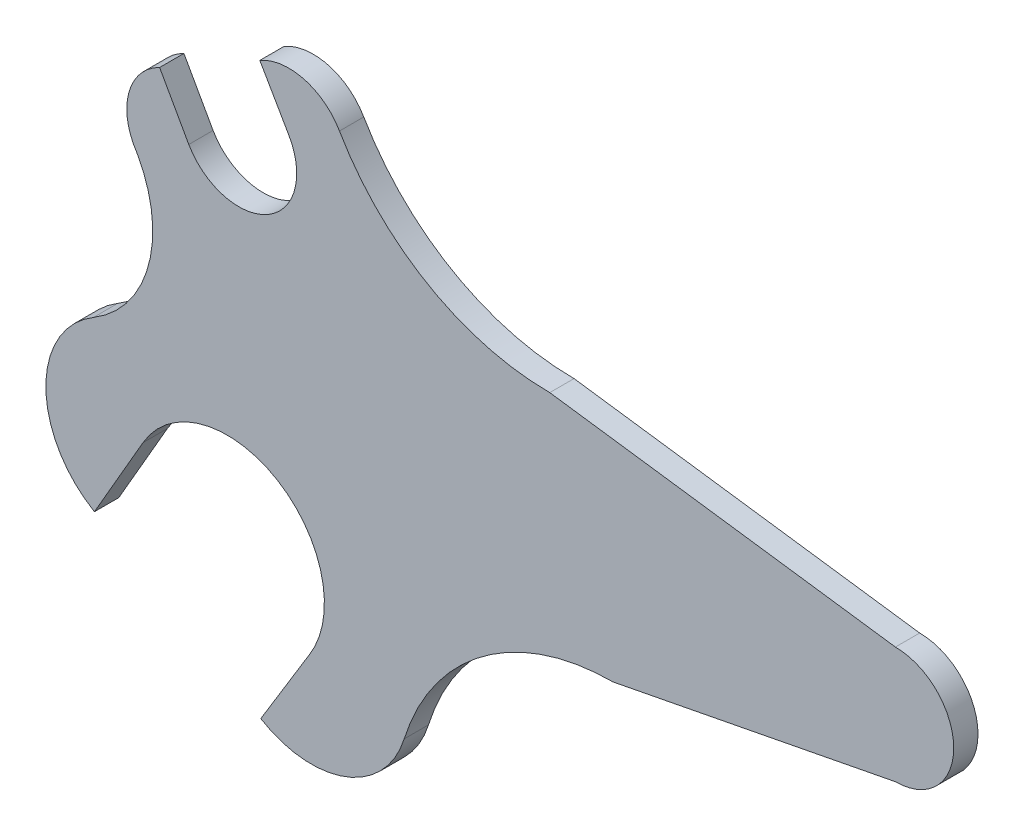
from build123d import *

# Parameters (mm, degrees)
BOSS_EXTRUDE2_DEPTH = 5


with BuildPart() as part:
    # Sketch1 → Boss-Extrude2 (new body)
    with BuildSketch(Plane.XY):
        with BuildLine():
            Line((-30.410051578, 28.86238305), (-36.410051578, 39.588721298))
            ThreePointArc((-36.410051578, 39.588721298), (-42.759129148, 31.880332669), (-41.076365657, 22.036636805))
            ThreePointArc((-41.076365657, 22.036636805), (-38.658640478, 3.297393101), (-50.044050262, -11.781635174))
            ThreePointArc((-50.044050262, -11.781635174), (-59.820088495, -29.100692514), (-49.820508076, -46.291651246))
            Line((-49.820508076, -46.291651246), (-39.820508076, -28.97114317))
            ThreePointArc((-39.820508076, -28.97114317), (-12.5, -21.650635095), (-5.179491924, -48.97114317))
            ThreePointArc((-5.179491924, -48.97114317), (-5.422797128, -49.381193221), (-5.675808094, -49.78532676))
            Line((-5.675808094, -49.78532676), (-15.589541975, -66.048346043))
            ThreePointArc((-15.589541975, -66.048346043), (1.883571693, -67.682453449), (13.918479383, -54.909787119))
            ThreePointArc((13.918479383, -54.909787119), (30.208282334, -32.034409255), (56.888914824, -23.271736004))
            Line((56.888914824, -23.271736004), (115, -12))
            ThreePointArc((115, -12), (127, 0), (115, 12))
            Line((115, 12), (43.874557006, 21.783515632))
            ThreePointArc((43.874557006, 21.783515632), (18.891003915, 28.477838507), (0.601773699, 46.767068722))
            ThreePointArc((0.601773699, 46.767068722), (-6.684702605, 52.358178638), (-15.790531146, 51.159373568))
            Line((-15.790531146, 51.159373568), (-9.790531146, 40.767068722))
            ThreePointArc((-9.790531146, 40.767068722), (-14.147948526, 24.50496567), (-30.410051578, 28.86238305))
        make_face()
    extrude(amount=BOSS_EXTRUDE2_DEPTH)


solid = part.part
